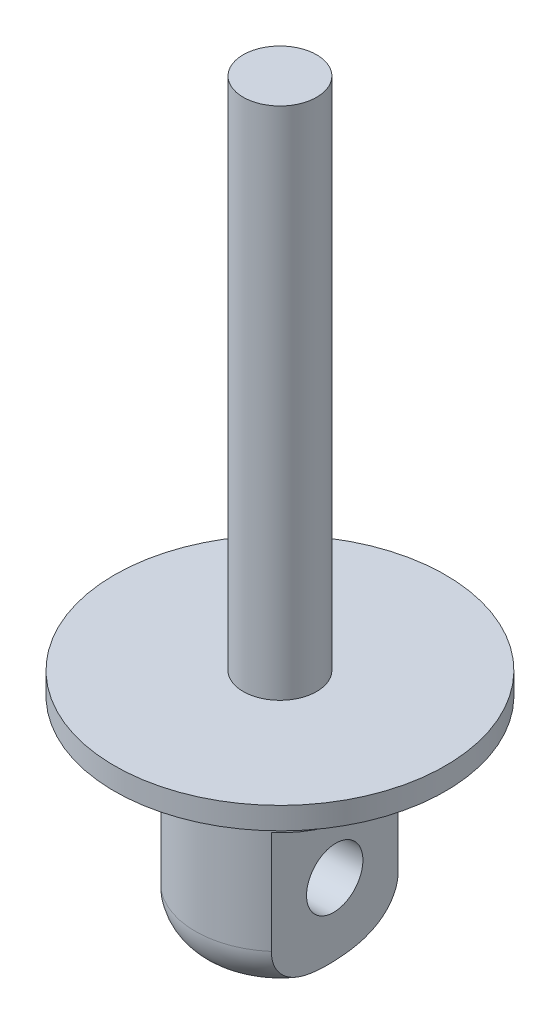
from build123d import *

# Parameters (mm, degrees)
FILLET1_R          = 6
SKETCH2_W          = 7.935978024
SKETCH2_H          = 33.147969744
CUT_EXTRUDE1_DEPTH = 20
SKETCH3_R          = 4
CUT_EXTRUDE2_DEPTH = 108.70389036


with BuildPart() as part:
    # Sketch1 → Revolve1 (revolve)
    with BuildSketch(Plane.XY, mode=Mode.PRIVATE) as revolve1_sk:
        Polygon((0, 0), (11.5, 0), (11.5, 28), (22.5, 28), (22.5, 31), (5, 31), (5, 101), (0, 101), align=None)
    revolve(revolve1_sk.sketch.rotate(Axis((0, 101, 0), (0, -1, 0)), 180), axis=Axis((0, 101, 0), (0, -1, 0)))

    # Fillet1
    fillet1_edges = [part.edges().sort_by_distance(p)[0] for p in [
        (11.5, 0, 0),
    ]]
    fillet(fillet1_edges, radius=FILLET1_R)

    # Sketch2 → Cut-Extrude1 (cut)
    with BuildSketch(Plane.XZ):
        Polygon((15.765034156, 15.943007174), (14.41031705, -17.177268183), (6.480969359, -16.852934437), (7.835686465, 16.26734092), align=None)
        with Locations((-11.132302547, 0)):
            Rectangle(SKETCH2_W, SKETCH2_H)
    extrude(amount=-CUT_EXTRUDE1_DEPTH, mode=Mode.SUBTRACT)

    # Sketch3 → Cut-Extrude2 (cut, through all)
    with BuildSketch(Plane(origin=(7.158327912, 0, -0.292796759), x_dir=(-0.040868780695827604, 0, -0.9991645223707837), z_dir=(0.9991645223707837, 0, -0.040868780695827604))):
        with Locations((0, 10)):
            Circle(SKETCH3_R)
    extrude(amount=-CUT_EXTRUDE2_DEPTH, mode=Mode.SUBTRACT)


solid = part.part
